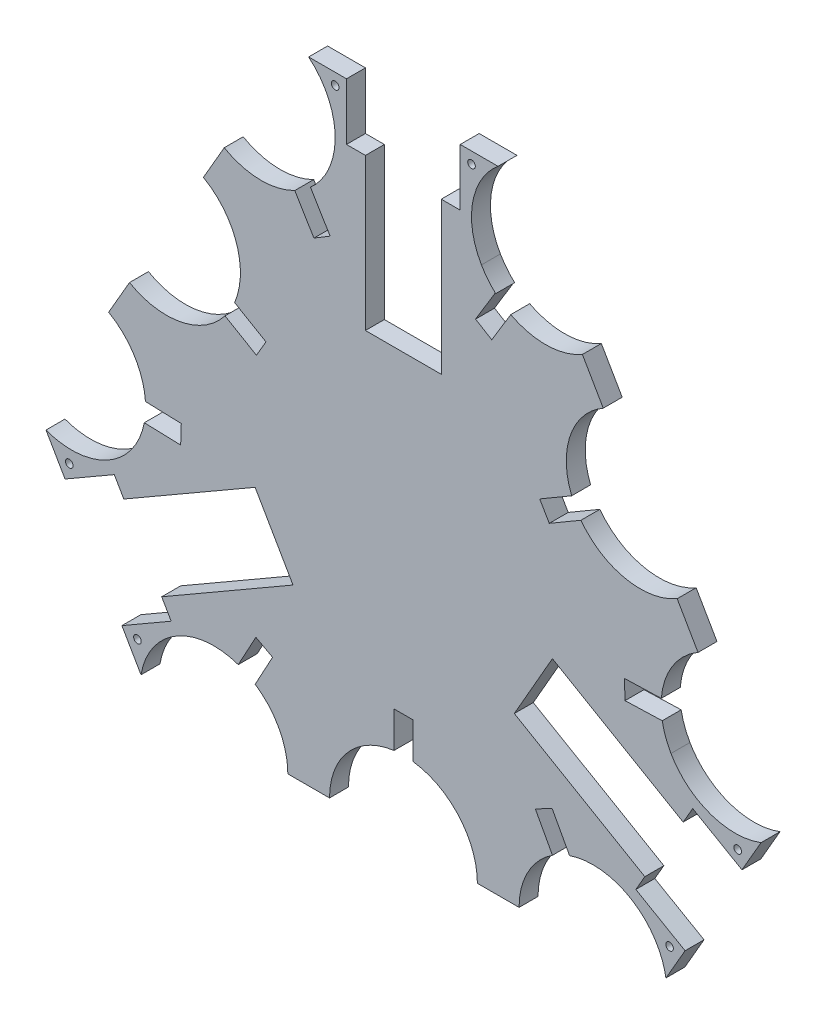
from build123d import *

# Parameters (mm, degrees)
MODEL_R            = 2
BOSS_EXTRU_1_DEPTH = 10


with BuildPart() as part:
    # Model → Boss.-Extru.1 (new body)
    with BuildSketch(Plane.XY):
        with BuildLine():
            Line((118.61641531, -1154.71765861), (127.930403211, -1137.550920057))
            Line((127.930403211, -1137.550920057), (136.72004758, -1142.319793484))
            Line((136.72004758, -1142.319793484), (127.561777994, -1159.199598646))
            add(Edge.make_bspline(
                [(127.561777994, -1159.199598646), (137.946329318, -1166.206535292), (144.775197591, -1178.081348795), (144.775197591, -1191.551327637)],
                knots=[5, 5, 5, 5, 6, 6, 6, 6], degree=3))
            Line((144.775197591, -1191.551327637), (166.775232855, -1191.551327637))
            add(Edge.make_bspline(
                [(166.775232855, -1191.551327637), (166.775232855, -1171.706328789), (181.59758393, -1155.323650906), (200.775224717, -1152.869278754)],
                knots=[7, 7, 7, 7, 8, 8, 8, 8], degree=3))
            Line((200.775224717, -1152.869278754), (200.775224717, -1133.844858588))
            Line((200.775224717, -1133.844858588), (210.775303385, -1133.844858588))
            Line((210.775303385, -1133.844858588), (210.775303385, -1152.869278754))
            add(Edge.make_bspline(
                [(210.775303385, -1152.869278754), (229.952944173, -1155.323650906), (244.775295247, -1171.706328789), (244.775295247, -1191.551327637)],
                knots=[11, 11, 11, 11, 12, 12, 12, 12], degree=3))
            Line((244.775295247, -1191.551327637), (266.775330512, -1191.551327637))
            add(Edge.make_bspline(
                [(266.775330512, -1191.551327637), (266.775330512, -1177.908060492), (273.782482476, -1165.903323825), (284.392859809, -1158.933637275)],
                knots=[13, 13, 13, 13, 14, 14, 14, 14], degree=3))
            Line((284.392859809, -1158.933637275), (275.378767469, -1142.319793484))
            Line((275.378767469, -1142.319793484), (284.168411838, -1137.550920057))
            Line((284.168411838, -1137.550920057), (293.396100097, -1154.558495198))
            add(Edge.make_bspline(
                [(293.396100097, -1154.558495198), (297.285612901, -1153.257454888), (301.447805013, -1152.551339504), (305.775189453, -1152.551339504)],
                knots=[17, 17, 17, 17, 18, 18, 18, 18], degree=3))
            add(Edge.make_bspline(
                [(305.775189453, -1152.551339504), (325.107170518, -1152.551339504), (341.150980197, -1166.618095011), (344.236752224, -1185.07381604)],
                knots=[18, 18, 18, 18, 19, 19, 19, 19], degree=3))
            Line((344.236752224, -1185.07381604), (354.349485514, -1167.558003187))
            Line((354.349485514, -1167.558003187), (328.371915256, -1152.559823052))
            Line((328.371915256, -1152.559823052), (333.130108886, -1144.318293375))
            Line((333.130108886, -1144.318293375), (264.271435112, -1104.214281331))
            Line((264.271435112, -1104.214281331), (284.368399631, -1069.09782015))
            Line((284.368399631, -1069.09782015), (353.359881836, -1109.279260715))
            Line((353.359881836, -1109.279260715), (358.371806749, -1100.598309109))
            Line((358.371806749, -1100.598309109), (384.349377007, -1115.59644618))
            Line((384.349377007, -1115.59644618), (394.422147189, -1098.149707492))
            add(Edge.make_bspline(
                [(394.422147189, -1098.149707492), (376.868524414, -1104.781903876), (356.593965223, -1097.927843343), (346.905839952, -1081.147558377)],
                knots=[28, 28, 28, 28, 29, 29, 29, 29], degree=3))
            add(Edge.make_bspline(
                [(346.905839952, -1081.147558377), (344.579194715, -1077.117744059), (343.055256727, -1072.845136637), (342.281143771, -1068.514393229)],
                knots=[29, 29, 29, 29, 30, 30, 30, 30], degree=3))
            Line((342.281143771, -1068.514393229), (322.666837131, -1069.139591932))
            Line((322.666837131, -1069.139591932), (322.348338053, -1059.144680908))
            Line((322.348338053, -1059.144680908), (341.805376085, -1058.524520657))
            add(Edge.make_bspline(
                [(341.805376085, -1058.524520657), (342.807554362, -1046.186987766), (349.649858507, -1034.529990424), (361.180765353, -1027.872601779)],
                knots=[33, 33, 33, 33, 34, 34, 34, 34], degree=3))
            Line((361.180765353, -1027.872601779), (350.180747721, -1008.820017958))
            add(Edge.make_bspline(
                [(350.180747721, -1008.820017958), (332.861563693, -1018.819235351), (311.063066514, -1014.022628906), (299.412959364, -998.355368164)],
                knots=[35, 35, 35, 35, 36, 36, 36, 36], degree=3))
            Line((299.412959364, -998.355368164), (282.706313313, -1008.121137275))
            Line((282.706313313, -1008.121137275), (277.659765191, -999.487900241))
            Line((277.659765191, -999.487900241), (294.51179427, -989.637209527))
            add(Edge.make_bspline(
                [(294.51179427, -989.637209527), (287.327047634, -971.892340888), (294.128699652, -951.115099202), (311.18088878, -941.270049832)],
                knots=[39, 39, 39, 39, 40, 40, 40, 40], degree=3))
            Line((311.18088878, -941.270049832), (300.180871148, -922.21746601))
            add(Edge.make_bspline(
                [(300.180871148, -922.21746601), (288.111668131, -929.185602268), (273.867231825, -928.967097086), (262.397130913, -922.893738254)],
                knots=[43, 43, 43, 43, 44, 44, 44, 44], degree=3))
            Line((262.397130913, -922.893738254), (252.374314615, -939.437259033))
            Line((252.374314615, -939.437259033), (243.821520562, -934.25557704))
            Line((243.821520562, -934.25557704), (254.184884548, -917.149988932))
            Line((254.184884548, -917.149988932), (254.43896034, -917.303898573))
            add(Edge.make_bspline(
                [(254.43896034, -917.303898573), (251.531472005, -914.659098768), (248.976244683, -911.528368245), (246.90591455, -907.942454481)],
                knots=[48, 48, 48, 48, 49, 49, 49, 49], degree=3))
            add(Edge.make_bspline(
                [(246.90591455, -907.942454481), (237.277044921, -891.265005615), (241.367579047, -870.433288357), (255.673338053, -858.509899007)],
                knots=[49, 49, 49, 49, 50, 50, 50, 50], degree=3))
            Line((255.673338053, -858.509899007), (247.962525336, -858.509899007))
            Line((247.962525336, -858.509899007), (235.71762245, -858.509899007))
            Line((235.71762245, -858.509899007), (235.71762245, -888.509876627))
            Line((235.71762245, -888.509876627), (225.717543782, -888.509876627))
            Line((225.717543782, -888.509876627), (225.717543782, -968.509903076))
            Line((225.717543782, -968.509903076), (185.717573622, -968.509903076))
            Line((185.717573622, -968.509903076), (185.717573622, -888.509876627))
            Line((185.717573622, -888.509876627), (175.717494954, -888.509876627))
            Line((175.717494954, -888.509876627), (175.717494954, -858.509899007))
            Line((175.717494954, -858.509899007), (163.472592068, -858.509899007))
            Line((163.472592068, -858.509899007), (155.761779351, -858.509899007))
            add(Edge.make_bspline(
                [(155.761779351, -858.509899007), (170.067538357, -870.433288357), (174.158072482, -891.265005615), (164.529202853, -907.942454481)],
                knots=[61, 61, 61, 61, 62, 62, 62, 62], degree=3))
            add(Edge.make_bspline(
                [(164.529202853, -907.942454481), (162.357759168, -911.703723605), (159.653531467, -914.965540012), (156.568103949, -917.689577013)],
                knots=[62, 62, 62, 62, 63, 63, 63, 63], degree=3))
            Line((156.568103949, -917.689577013), (156.730884711, -917.590961154))
            Line((156.730884711, -917.590961154), (167.094248697, -934.696549262))
            Line((167.094248697, -934.696549262), (158.541454644, -939.878231255))
            Line((158.541454644, -939.878231255), (148.439573405, -923.204399739))
            add(Edge.make_bspline(
                [(148.439573405, -923.204399739), (137.075236924, -928.972781494), (123.114504231, -929.064937798), (111.254246256, -922.21746601)],
                knots=[67, 67, 67, 67, 68, 68, 68, 68], degree=3))
            Line((111.254246256, -922.21746601), (100.254228624, -941.270049832))
            add(Edge.make_bspline(
                [(100.254228624, -941.270049832), (117.498998589, -951.226203532), (124.261721028, -972.363070122), (116.675965277, -990.237259033)],
                knots=[71, 71, 71, 71, 72, 72, 72, 72], degree=3))
            Line((116.675965277, -990.237259033), (133.255831814, -999.928872463))
            Line((133.255831814, -999.928872463), (128.209283691, -1008.562109497))
            Line((128.209283691, -1008.562109497), (111.632173231, -998.872089423))
            add(Edge.make_bspline(
                [(111.632173231, -998.872089423), (99.89077105, -1014.127489), (78.381834147, -1018.708604723), (61.254197428, -1008.819974894)],
                knots=[75, 75, 75, 75, 76, 76, 76, 76], degree=3))
            Line((61.254197428, -1008.819974894), (50.254179796, -1027.872558716))
            add(Edge.make_bspline(
                [(50.254179796, -1027.872558716), (61.92823036, -1034.612500461), (68.798784288, -1046.476375786), (69.666603841, -1058.983192057)],
                knots=[79, 79, 79, 79, 80, 80, 80, 80], degree=3))
            Line((69.666603841, -1058.983192057), (88.567431206, -1059.58565313))
            Line((88.567431206, -1059.58565313), (88.248759874, -1069.580564155))
            Line((88.248759874, -1069.580564155), (69.068879774, -1068.969231961))
            add(Edge.make_bspline(
                [(69.068879774, -1068.969231961), (68.270995659, -1073.144084798), (66.77444618, -1077.258906847), (64.529277452, -1081.147558377)],
                knots=[83, 83, 83, 83, 84, 84, 84, 84], degree=3))
            add(Edge.make_bspline(
                [(64.529277452, -1081.147558377), (54.876636664, -1097.866434516), (34.714904351, -1104.731734673), (17.205723307, -1098.222140625)],
                knots=[84, 84, 84, 84, 85, 85, 85, 85], degree=3))
            Line((17.205723307, -1098.222140625), (21.089379448, -1104.948818752))
            Line((21.089379448, -1104.948818752), (27.24318126, -1115.607384359))
            Line((27.24318126, -1115.607384359), (53.239699544, -1100.598309109))
            Line((53.239699544, -1100.598309109), (58.239566623, -1109.258590142))
            Line((58.239566623, -1109.258590142), (127.521642632, -1069.258576918))
            Line((127.521642632, -1069.258576918), (147.521627712, -1103.899571859))
            Line((147.521627712, -1103.899571859), (78.239551703, -1143.899628146))
            Line((78.239551703, -1143.899628146), (83.239591037, -1152.559823052))
            Line((83.239591037, -1152.559823052), (57.243245008, -1167.568898302))
            Line((57.243245008, -1167.568898302), (63.432359049, -1178.288829671))
            Line((63.432359049, -1178.288829671), (67.321699598, -1185.02567083))
            add(Edge.make_bspline(
                [(67.321699598, -1185.02567083), (70.427280924, -1166.593634833), (86.460066297, -1152.551339504), (105.775166395, -1152.551339504)],
                knots=[0, 0, 0, 0, 1, 1, 1, 1], degree=3))
            add(Edge.make_bspline(
                [(105.775166395, -1152.551339504), (110.274633355, -1152.551339504), (114.594955349, -1153.315763129), (118.61641531, -1154.71765861)],
                knots=[1, 1, 1, 1, 2, 2, 2, 2], degree=3))
        make_face()
        with Locations((65.451386675, -1169.708192825)):
            Circle(MODEL_R, mode=Mode.SUBTRACT)
        with Locations((29.494548276, -1107.429239443)):
            Circle(MODEL_R, mode=Mode.SUBTRACT)
        with Locations((169.760752604, -864.530547878)):
            Circle(MODEL_R, mode=Mode.SUBTRACT)
        with Locations((241.6743648, -864.530504815)):
            Circle(MODEL_R, mode=Mode.SUBTRACT)
        with Locations((382.116933599, -1107.429281733)):
            Circle(MODEL_R, mode=Mode.SUBTRACT)
        with Locations((346.16022151, -1169.708251653)):
            Circle(MODEL_R, mode=Mode.SUBTRACT)
    extrude(amount=BOSS_EXTRU_1_DEPTH)


solid = part.part
